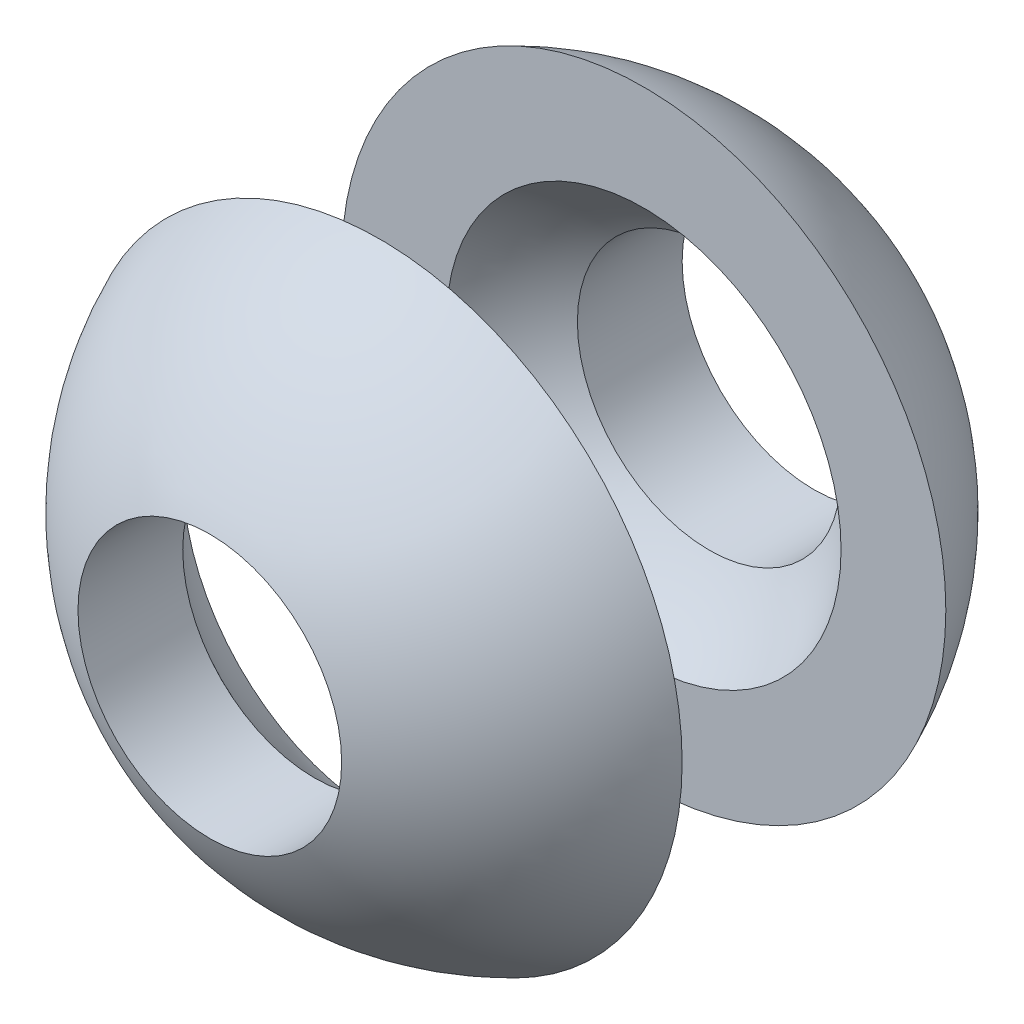
from build123d import *


with BuildPart() as part:
    # Sketch1 → Revolve1 (revolve)
    with BuildSketch(Plane(origin=(0, 0, 0), x_dir=(1, 0, 0), z_dir=(0, 1, 0))):
        with BuildLine():
            ThreePointArc((5, -7.483314774), (6.363961031, -6.363961031), (7.483314774, -5))
            Line((7.483314774, -5), (11.456439237, -5))
            ThreePointArc((11.456439237, -5), (8.838834765, -8.838834765), (5, -11.456439237))
            Line((5, -11.456439237), (5, -7.483314774))
        make_face()
        with BuildLine():
            Line((7.483314774, 5), (11.456439237, 5))
            ThreePointArc((11.456439237, 5), (8.838834765, 8.838834765), (5, 11.456439237))
            Line((5, 11.456439237), (5, 7.483314774))
            ThreePointArc((5, 7.483314774), (6.363961031, 6.363961031), (7.483314774, 5))
        make_face()
    revolve(axis=Axis((0, 0, -14.515186916), (0, 0, 1)))


solid = part.part
